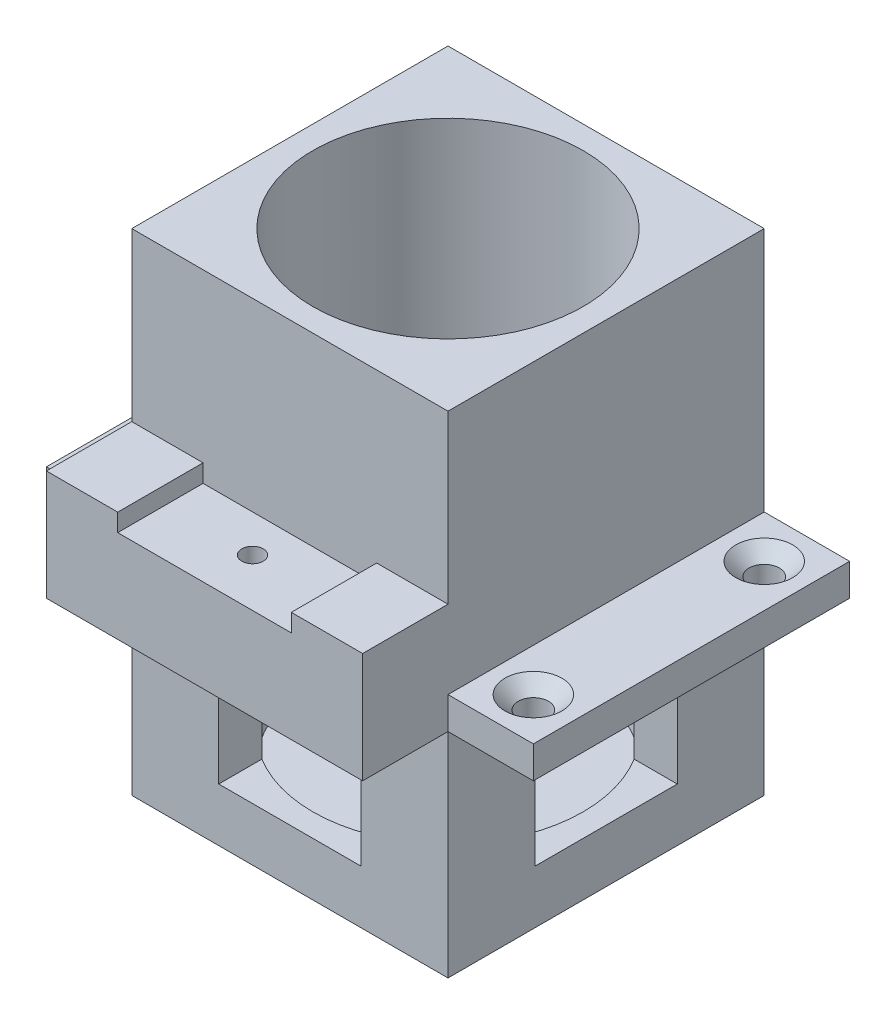
from build123d import *

# Parameters (mm, degrees)
SKETCH1_W                     = 44.45
SKETCH1_H                     = 44.45
BOSS_EXTRUDE1_DEPTH           = 90
SKETCH2_R                     = 19
CUT_EXTRUDE1_DEPTH            = 45
SKETCH3_R                     = 19
CUT_EXTRUDE2_DEPTH            = 41
SKETCH4_W                     = 44.45
SKETCH4_H                     = 44.45
CUT_EXTRUDE3_DEPTH            = 21
SKETCH6_W                     = 20
SKETCH6_H                     = 15
CUT_EXTRUDE4_DEPTH            = 86.033835178
SKETCH8_W                     = 20
SKETCH8_H                     = 15
CUT_EXTRUDE5_DEPTH            = 86.033835178
BOSS_EXTRUDE2_DEPTH           = 12
SKETCH20_R                    = 1.51
CUT_EXTRUDE6_DEPTH            = 13
SKETCH21_W                    = 44.45
SKETCH21_H                    = 4
BOSS_EXTRUDE4_DEPTH           = 12
SKETCH22_R                    = 4
CUT_EXTRUDE11_DEPTH           = 2
CUT_EXTRUDE11_DRAFT           = -45
CUT_EXTRUDE11_PROFILE_2_DEPTH = 2
CUT_EXTRUDE11_PROFILE_2_DRAFT = -45
CUT_EXTRUDE11_PROFILE_3_DEPTH = 2
CUT_EXTRUDE11_PROFILE_3_DRAFT = -45
CUT_EXTRUDE11_PROFILE_4_DEPTH = 2
CUT_EXTRUDE11_PROFILE_4_DRAFT = -45
SKETCH23_R                    = 2
CUT_EXTRUDE12_DEPTH           = 12
SKETCH24_W                    = 44.45
SKETCH24_H                    = 4.5
BOSS_EXTRUDE5_DEPTH           = 12
SKETCH25_R                    = 4
CUT_EXTRUDE13_DEPTH           = 2
CUT_EXTRUDE13_DRAFT           = -45
CUT_EXTRUDE13_PROFILE_2_DEPTH = 2
CUT_EXTRUDE13_PROFILE_2_DRAFT = -45
SKETCH26_R                    = 2.125
CUT_EXTRUDE14_DEPTH           = 12


with BuildPart() as part:
    # Sketch1 → Boss-Extrude1 (new body)
    with BuildSketch(Plane(origin=(0, 0, 0), x_dir=(1, 0, 0), z_dir=(0, 1, 0))):
        Rectangle(SKETCH1_W, SKETCH1_H)
    extrude(amount=BOSS_EXTRUDE1_DEPTH)

    # Sketch2 → Cut-Extrude1 (cut)
    with BuildSketch(Plane(origin=(0, 90, 0), x_dir=(1, 0, 0), z_dir=(0, 1, 0))):
        with Locations(Location((0, 0, 0), (0, 0, 270))):
            Circle(SKETCH2_R)
    extrude(amount=-CUT_EXTRUDE1_DEPTH, mode=Mode.SUBTRACT)

    # Sketch3 → Cut-Extrude2 (cut)
    with BuildSketch(Plane(origin=(0, 45, 0), x_dir=(1, 0, 0), z_dir=(0, 1, 0))):
        with Locations(Location((0, 0, 0), (0, 0, 270))):
            Circle(SKETCH3_R)
    extrude(amount=-CUT_EXTRUDE2_DEPTH, mode=Mode.SUBTRACT)

    # Sketch4 → Cut-Extrude3 (cut)
    with BuildSketch(Plane(origin=(0, 90, 0), x_dir=(1, 0, 0), z_dir=(0, 1, 0))):
        Rectangle(SKETCH4_W, SKETCH4_H)
    extrude(amount=-CUT_EXTRUDE3_DEPTH, mode=Mode.SUBTRACT)

    # Sketch6 → Cut-Extrude4 (cut, through all)
    with BuildSketch(Plane.XY.offset(22.225)):
        with Locations((0, 15)):
            Rectangle(SKETCH6_W, SKETCH6_H)
    extrude(amount=-CUT_EXTRUDE4_DEPTH, mode=Mode.SUBTRACT)

    # Sketch8 → Cut-Extrude5 (cut, through all)
    with BuildSketch(Plane.ZY.offset(22.225)):
        with Locations((0, 15)):
            Rectangle(SKETCH8_W, SKETCH8_H)
    extrude(amount=-CUT_EXTRUDE5_DEPTH, mode=Mode.SUBTRACT)

    # Sketch18 → Boss-Extrude2 (add)
    with BuildSketch(Plane.XY.offset(22.225)):
        Polygon((12.2, 45.5), (22.225, 45.5), (22.225, 30), (-22.225, 30), (-22.225, 45.5), (-12.2, 45.5), (-12.2, 43), (12.2, 43), align=None)
    extrude(amount=BOSS_EXTRUDE2_DEPTH)

    # Sketch20 → Cut-Extrude6 (cut)
    with BuildSketch(Plane(origin=(0, 43, 0), x_dir=(1, 0, 0), z_dir=(0, 1, 0))):
        with Locations(Location((0, -27.475, 0), (0, 0, 270))):
            Circle(SKETCH20_R)
    extrude(amount=-CUT_EXTRUDE6_DEPTH, mode=Mode.SUBTRACT)

    # Sketch21 → Boss-Extrude4 (add)
    with BuildSketch(Plane.ZY.offset(22.225)):
        with Locations((0, 32)):
            Rectangle(SKETCH21_W, SKETCH21_H)
    extrude(amount=BOSS_EXTRUDE4_DEPTH)


with BuildPart() as cut_extrude11_tool:
    # Sketch22 → Cut-Extrude11 (with draft: the straight prism first)
    with BuildSketch(Plane(origin=(0, 34, 0), x_dir=(1, 0, 0), z_dir=(0, 1, 0))):
        with Locations((-28.225, -16.225)):
            Circle(SKETCH22_R)
    extrude(amount=-CUT_EXTRUDE11_DEPTH)
    # Cut-Extrude11: the draft: its side faces are tilted about the plane it starts from
    cut_extrude11_sides = [cut_extrude11_tool.faces().sort_by_distance(p)[0] for p in [
        (-32.225, 33, 16.225),
    ]]
    draft(cut_extrude11_sides, Plane(origin=(0, 34, 0), x_dir=(1, 0, 0), z_dir=(0, 1, 0)), CUT_EXTRUDE11_DRAFT)


with BuildPart() as part_1:
    add(part.part)

    # Cut-Extrude11: cut by cut_extrude11_tool
    add(cut_extrude11_tool.part, mode=Mode.SUBTRACT)


with BuildPart() as cut_extrude11_profile_2_tool:
    # Sketch22 → Cut-Extrude11 profile 2 (with draft: the straight prism first)
    with BuildSketch(Plane(origin=(0, 34, 0), x_dir=(1, 0, 0), z_dir=(0, 1, 0))):
        with Locations((-28.225, 16.225)):
            Circle(SKETCH22_R)
    extrude(amount=-CUT_EXTRUDE11_PROFILE_2_DEPTH)
    # Cut-Extrude11 profile 2: the draft: its side faces are tilted about the plane it starts from
    cut_extrude11_profile_2_sides = [cut_extrude11_profile_2_tool.faces().sort_by_distance(p)[0] for p in [
        (-32.225, 33, -16.225),
    ]]
    draft(cut_extrude11_profile_2_sides, Plane(origin=(0, 34, 0), x_dir=(1, 0, 0), z_dir=(0, 1, 0)), CUT_EXTRUDE11_PROFILE_2_DRAFT)


with BuildPart() as part_2:
    add(part_1.part)

    # Cut-Extrude11 profile 2: cut by cut_extrude11_profile_2_tool
    add(cut_extrude11_profile_2_tool.part, mode=Mode.SUBTRACT)


with BuildPart() as cut_extrude11_profile_3_tool:
    # Sketch22 → Cut-Extrude11 profile 3 (with draft: the straight prism first)
    with BuildSketch(Plane(origin=(0, 34, 0), x_dir=(1, 0, 0), z_dir=(0, 1, 0))):
        with Locations((28.225, -16.225)):
            Circle(SKETCH22_R)
    extrude(amount=-CUT_EXTRUDE11_PROFILE_3_DEPTH)
    # Cut-Extrude11 profile 3: the draft: its side faces are tilted about the plane it starts from
    cut_extrude11_profile_3_sides = [cut_extrude11_profile_3_tool.faces().sort_by_distance(p)[0] for p in [
        (24.225, 33, 16.225),
    ]]
    draft(cut_extrude11_profile_3_sides, Plane(origin=(0, 34, 0), x_dir=(1, 0, 0), z_dir=(0, 1, 0)), CUT_EXTRUDE11_PROFILE_3_DRAFT)


with BuildPart() as part_3:
    add(part_2.part)

    # Cut-Extrude11 profile 3: cut by cut_extrude11_profile_3_tool
    add(cut_extrude11_profile_3_tool.part, mode=Mode.SUBTRACT)


with BuildPart() as cut_extrude11_profile_4_tool:
    # Sketch22 → Cut-Extrude11 profile 4 (with draft: the straight prism first)
    with BuildSketch(Plane(origin=(0, 34, 0), x_dir=(1, 0, 0), z_dir=(0, 1, 0))):
        with Locations((28.225, 16.225)):
            Circle(SKETCH22_R)
    extrude(amount=-CUT_EXTRUDE11_PROFILE_4_DEPTH)
    # Cut-Extrude11 profile 4: the draft: its side faces are tilted about the plane it starts from
    cut_extrude11_profile_4_sides = [cut_extrude11_profile_4_tool.faces().sort_by_distance(p)[0] for p in [
        (24.225, 33, -16.225),
    ]]
    draft(cut_extrude11_profile_4_sides, Plane(origin=(0, 34, 0), x_dir=(1, 0, 0), z_dir=(0, 1, 0)), CUT_EXTRUDE11_PROFILE_4_DRAFT)


with BuildPart() as part_4:
    add(part_3.part)

    # Cut-Extrude11 profile 4: cut by cut_extrude11_profile_4_tool
    add(cut_extrude11_profile_4_tool.part, mode=Mode.SUBTRACT)

    # Sketch23 → Cut-Extrude12 (cut)
    with BuildSketch(Plane(origin=(0, 34, 0), x_dir=(1, 0, 0), z_dir=(0, 1, 0))):
        with Locations(Location((-28.225, -16.225, 0), (0, 0, 270))):
            Circle(SKETCH23_R)
        with Locations(Location((-28.225, 16.225, 0), (0, 0, 90))):
            Circle(SKETCH23_R)
    extrude(amount=-CUT_EXTRUDE12_DEPTH, mode=Mode.SUBTRACT)

    # Sketch24 → Boss-Extrude5 (add)
    with BuildSketch(Plane(origin=(22.225, 0, 0), x_dir=(0, 0, -1), z_dir=(1, 0, 0))):
        with Locations((0, 32.25)):
            Rectangle(SKETCH24_W, SKETCH24_H)
    extrude(amount=BOSS_EXTRUDE5_DEPTH)


with BuildPart() as cut_extrude13_tool:
    # Sketch25 → Cut-Extrude13 (with draft: the straight prism first)
    with BuildSketch(Plane(origin=(0, 34.5, 0), x_dir=(1, 0, 0), z_dir=(0, 1, 0))):
        with Locations((28.225, 16.225)):
            Circle(SKETCH25_R)
    extrude(amount=-CUT_EXTRUDE13_DEPTH)
    # Cut-Extrude13: the draft: its side faces are tilted about the plane it starts from
    cut_extrude13_sides = [cut_extrude13_tool.faces().sort_by_distance(p)[0] for p in [
        (24.225, 33.5, -16.225),
    ]]
    draft(cut_extrude13_sides, Plane(origin=(0, 34.5, 0), x_dir=(1, 0, 0), z_dir=(0, 1, 0)), CUT_EXTRUDE13_DRAFT)


with BuildPart() as part_5:
    add(part_4.part)

    # Cut-Extrude13: cut by cut_extrude13_tool
    add(cut_extrude13_tool.part, mode=Mode.SUBTRACT)


with BuildPart() as cut_extrude13_profile_2_tool:
    # Sketch25 → Cut-Extrude13 profile 2 (with draft: the straight prism first)
    with BuildSketch(Plane(origin=(0, 34.5, 0), x_dir=(1, 0, 0), z_dir=(0, 1, 0))):
        with Locations((28.225, -16.225)):
            Circle(SKETCH25_R)
    extrude(amount=-CUT_EXTRUDE13_PROFILE_2_DEPTH)
    # Cut-Extrude13 profile 2: the draft: its side faces are tilted about the plane it starts from
    cut_extrude13_profile_2_sides = [cut_extrude13_profile_2_tool.faces().sort_by_distance(p)[0] for p in [
        (24.225, 33.5, 16.225),
    ]]
    draft(cut_extrude13_profile_2_sides, Plane(origin=(0, 34.5, 0), x_dir=(1, 0, 0), z_dir=(0, 1, 0)), CUT_EXTRUDE13_PROFILE_2_DRAFT)


with BuildPart() as part_6:
    add(part_5.part)

    # Cut-Extrude13 profile 2: cut by cut_extrude13_profile_2_tool
    add(cut_extrude13_profile_2_tool.part, mode=Mode.SUBTRACT)

    # Sketch26 → Cut-Extrude14 (cut)
    with BuildSketch(Plane(origin=(0, 34.5, 0), x_dir=(1, 0, 0), z_dir=(0, 1, 0))):
        with Locations(Location((28.225, 16.225, 0), (0, 0, 270))):
            Circle(SKETCH26_R)
        with Locations(Location((28.225, -16.225, 0), (0, 0, 270))):
            Circle(SKETCH26_R)
    extrude(amount=-CUT_EXTRUDE14_DEPTH, mode=Mode.SUBTRACT)


solid = part_6.part
